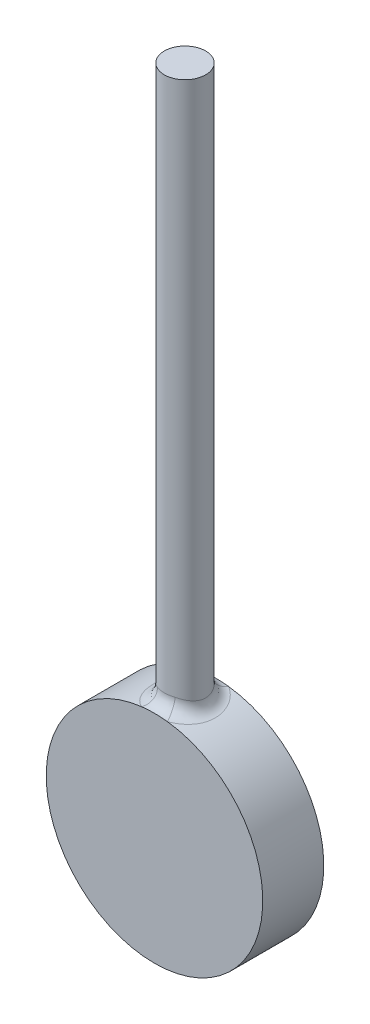
from build123d import *

# Parameters (mm, degrees)
SKETCH1_R           = 4.191
BOSS_EXTRUDE1_DEPTH = 1.1811
SKETCH2_R           = 0.8001
BOSS_EXTRUDE2_DEPTH = 25.4
FILLET1_R           = 0.508


with BuildPart() as part:
    # Sketch1 → Boss-Extrude1 (new, symmetric)
    with BuildSketch(Plane.XY):
        Circle(SKETCH1_R)
    extrude(amount=BOSS_EXTRUDE1_DEPTH, both=True)

    # Sketch2 → Boss-Extrude2 (add)
    with BuildSketch(Plane(origin=(0, 0, 0), x_dir=(1, 0, 0), z_dir=(0, 1, 0))):
        with Locations(Location((0, 0, 0), (0, 0, 90))):
            Circle(SKETCH2_R)
    extrude(amount=BOSS_EXTRUDE2_DEPTH)

    # Fillet1
    fillet1_edges = [part.edges().sort_by_distance(p)[0] for p in [
        (0, 4.191, 0.8001),
    ]]
    fillet(fillet1_edges, radius=FILLET1_R)


solid = part.part
